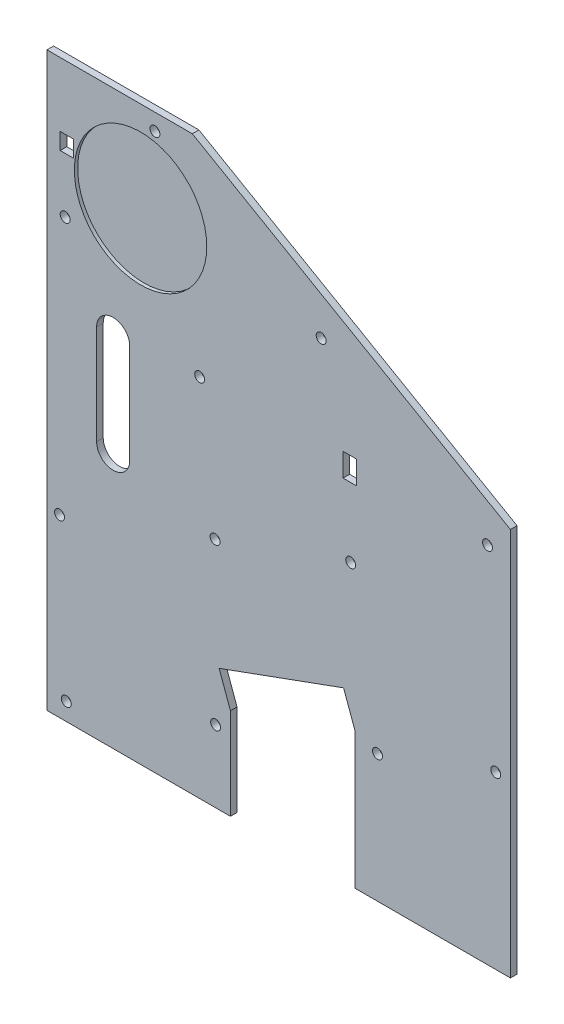
from build123d import *

# Parameters (mm, degrees)
BOSS_EXTRUDE1_DEPTH         = 2
SKETCH3_W                   = 4.004504799
SKETCH3_H                   = 7.007808652
SKETCH3_W_2                 = 4
SKETCH3_H_2                 = 5
CUT_EXTRUDE1_DEPTH          = 10
SKETCH4_R                   = 20
CUT_EXTRUDE2_DEPTH          = 1
F_3_0MM_PRESS_DOWEL_HOLE1_D = 3
CUT_EXTRUDE3_DEPTH          = 272.480461976


with BuildPart() as part:
    # Sketch1 → Boss-Extrude1 (new body)
    with BuildSketch(Plane.XY):
        Polygon((-70, 100), (-70, -72.799540117), (70, -72.799540117), (70, 44.524791386), (-26.08587988, 100), align=None)
    extrude(amount=BOSS_EXTRUDE1_DEPTH)

    # Sketch3 → Cut-Extrude1 (cut)
    with BuildSketch(Plane.XY.offset(2)):
        with Locations((21.429491924, 36.193920339)):
            Rectangle(SKETCH3_W, SKETCH3_H)
        with Locations((-64, 78.155444566)):
            Rectangle(SKETCH3_W_2, SKETCH3_H_2)
        Polygon((-14.572335871, -75.184527756), (23.015368961, -75.184527756), (23.015368961, -31.503722023), (19.595167527, -22.106795815), (-17.992537304, -35.787601548), (-14.572335871, -45.184527756), align=None)
    extrude(amount=-CUT_EXTRUDE1_DEPTH, mode=Mode.SUBTRACT)

    # Sketch4 → Cut-Extrude2 (cut)
    with BuildSketch(Plane.XY.offset(2)):
        with Locations((-41.723720558, 72.655444566)):
            Circle(SKETCH4_R)
    extrude(amount=-CUT_EXTRUDE2_DEPTH, mode=Mode.SUBTRACT)

    # Ø3.0mm Press Dowel Hole1 (through all)
    with Locations(Plane(origin=(-89.742029537, -119.499715795, 0), x_dir=(-1, 0, 0), z_dir=(0, 0, -1))):
        with Locations((-23.542258378, 99.781049413), (-25.594379238, 52.014538143), (-70.699625036, 68.431505023), (-70.526889417, 116.882056579), (-111.491838386, 131.259989766), (-119.586439667, 85.314281565), (-155.294759257, 98.311047011), (-152.806439447, 156.481766603), (-65.878236217, 157.017664987), (-102.576966028, 185.481766603), (-52.347492608, 214.481766603), (-25.242029537, 178.499715795)):
            Hole(F_3_0MM_PRESS_DOWEL_HOLE1_D / 2)

    # Sketch7 → Cut-Extrude3 (cut, through all)
    with BuildSketch(Plane(origin=(-89.742029537, -119.499715795, 2), x_dir=(1, 0, 0), z_dir=(0, 0, 1))):
        with BuildLine():
            Line((44.742029537, 154.499715795), (44.742029537, 124.499715795))
            ThreePointArc((44.742029537, 124.499715795), (39.742029537, 119.499715795), (34.742029537, 124.499715795))
            Line((34.742029537, 124.499715795), (34.742029537, 154.499715795))
            ThreePointArc((34.742029537, 154.499715795), (39.742029537, 159.499715795), (44.742029537, 154.499715795))
        make_face()
    extrude(amount=-CUT_EXTRUDE3_DEPTH, mode=Mode.SUBTRACT)


solid = part.part
